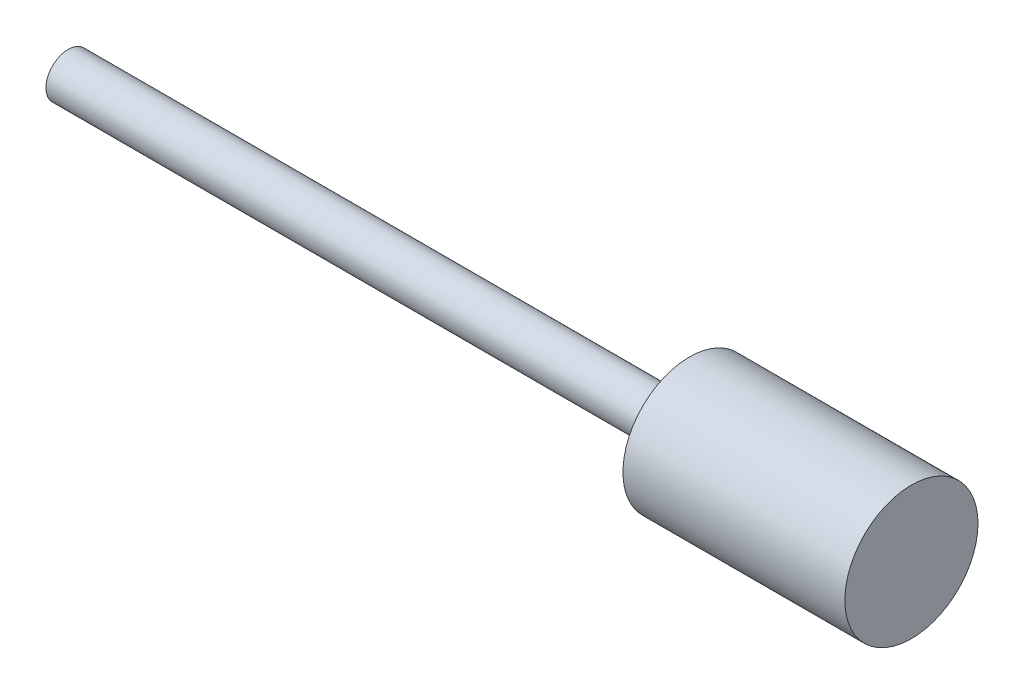
from build123d import *

# Parameters (mm, degrees)
SKETCH1_R           = 5
BOSS_EXTRUDE1_DEPTH = 140
SKETCH2_R           = 15
BOSS_EXTRUDE2_DEPTH = 50


with BuildPart() as part:
    # Sketch1 → Boss-Extrude1 (new body)
    with BuildSketch(Plane(origin=(0, 0, 0), x_dir=(0, 0, -1), z_dir=(1, 0, 0))):
        Circle(SKETCH1_R)
    extrude(amount=BOSS_EXTRUDE1_DEPTH)

    # Sketch2 → Boss-Extrude2 (add)
    with BuildSketch(Plane(origin=(140, 0, 0), x_dir=(0, 0, -1), z_dir=(1, 0, 0))):
        Circle(SKETCH2_R)
    extrude(amount=BOSS_EXTRUDE2_DEPTH)


solid = part.part
